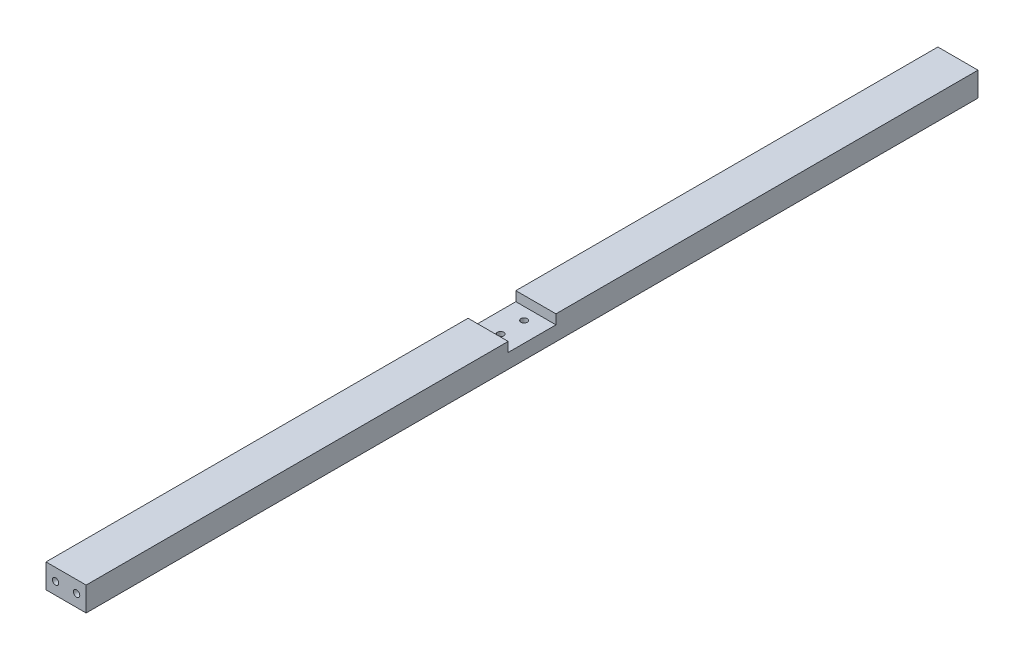
from build123d import *

# Parameters (mm, degrees)
ESQUISSE1_W             = 63
ESQUISSE1_H             = 38
BOSS_EXTRU_1_DEPTH      = 1400
ESQUISSE2_R             = 5
ENL_V_MAT_EXTRU_1_DEPTH = 50
ENL_V_START             = -1350
ESQUISSE2_2_R           = 5
ENL_V_MAT_EXTRU_2_DEPTH = 50
ESQUISSE3_W             = 63
ESQUISSE3_H             = 75
ENL_V_MAT_EXTRU_3_DEPTH = 15
ESQUISSE4_R             = 5
ENL_V_MAT_EXTRU_4_DEPTH = 1402.60550798


with BuildPart() as part:
    # Esquisse1 → Boss.-Extru.1 (new body)
    with BuildSketch(Plane.XY):
        with Locations((31.5, 19)):
            Rectangle(ESQUISSE1_W, ESQUISSE1_H)
    extrude(amount=BOSS_EXTRU_1_DEPTH)

    # Esquisse2 → Enlèv. mat.-Extru.1 (cut)
    with BuildSketch(Plane.XY.offset(1400)):
        with Locations((15, 19)):
            Circle(ESQUISSE2_R)
        with Locations(Location((48, 19, 0), (0, 0, 180))):
            Circle(ESQUISSE2_R)
    extrude(amount=-ENL_V_MAT_EXTRU_1_DEPTH, mode=Mode.SUBTRACT)

    # Esquisse2<2> → Enlèv. mat.-Extru.2 (cut)
    with BuildSketch(Plane.XY.offset(1400).offset(ENL_V_START)):
        with Locations((15, 19)):
            Circle(ESQUISSE2_2_R)
        with Locations(Location((48, 19, 0), (0, 0, 180))):
            Circle(ESQUISSE2_2_R)
    extrude(amount=-ENL_V_MAT_EXTRU_2_DEPTH, mode=Mode.SUBTRACT)

    # Esquisse3 → Enlèv. mat.-Extru.3 (cut)
    with BuildSketch(Plane(origin=(0, 38, 0), x_dir=(1, 0, 0), z_dir=(0, 1, 0))):
        with Locations((31.5, -700)):
            Rectangle(ESQUISSE3_W, ESQUISSE3_H)
    extrude(amount=-ENL_V_MAT_EXTRU_3_DEPTH, mode=Mode.SUBTRACT)

    # Esquisse4 → Enlèv. mat.-Extru.4 (cut, through all)
    with BuildSketch(Plane(origin=(0, 23, 0), x_dir=(1, 0, 0), z_dir=(0, 1, 0))):
        with Locations(Location((32, -718.5, 0), (0, 0, 270))):
            Circle(ESQUISSE4_R)
        with Locations(Location((32, -681.5, 0), (0, 0, 90))):
            Circle(ESQUISSE4_R)
    extrude(amount=-ENL_V_MAT_EXTRU_4_DEPTH, mode=Mode.SUBTRACT)


solid = part.part
